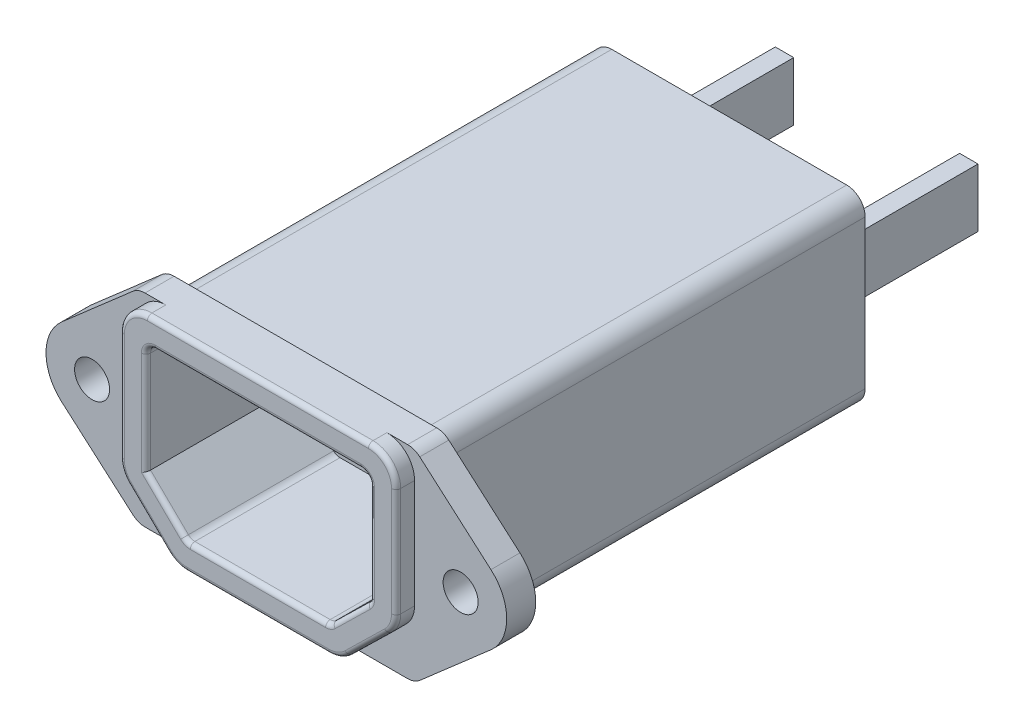
from build123d import *

# Parameters (mm, degrees)
SKETCH1_R           = 1.9
BOSS_EXTRUDE1_DEPTH = 3.15
BOSS_EXTRUDE2_DEPTH = 2
FILLET1_R           = 0.5
BOSS_EXTRUDE3_DEPTH = 46
SKETCH4_W           = 2
SKETCH4_H           = 6.35
BOSS_EXTRUDE4_DEPTH = 16
CUT_EXTRUDE1_START  = -11.1
CUT_EXTRUDE1_DEPTH  = 11.1


with BuildPart() as part:
    # Sketch1 → Boss-Extrude1 (new body)
    with BuildSketch(Plane.XY):
        with BuildLine():
            Line((-15.565068493, 10.506849315), (-23.287671233, 3.767123288))
            ThreePointArc((-23.287671233, 3.767123288), (-25, 0), (-23.287671233, -3.767123288))
            Line((-23.287671233, -3.767123288), (-15.565068493, -10.506849315))
            ThreePointArc((-15.565068493, -10.506849315), (-14.952246883, -10.872658355), (-14.25, -11))
            Line((-14.25, -11), (14.25, -11))
            ThreePointArc((14.25, -11), (14.952246883, -10.872658355), (15.565068493, -10.506849315))
            Line((15.565068493, -10.506849315), (23.287671233, -3.767123288))
            ThreePointArc((23.287671233, -3.767123288), (25, 0), (23.287671233, 3.767123288))
            Line((23.287671233, 3.767123288), (15.565068493, 10.506849315))
            ThreePointArc((15.565068493, 10.506849315), (14.952246883, 10.872658355), (14.25, 11))
            Line((14.25, 11), (-14.25, 11))
            ThreePointArc((-14.25, 11), (-14.952246883, 10.872658355), (-15.565068493, 10.506849315))
        make_face()
        with Locations((-20, 0)):
            Circle(SKETCH1_R, mode=Mode.SUBTRACT)
        with Locations((20, 0)):
            Circle(SKETCH1_R, mode=Mode.SUBTRACT)
        with BuildLine():
            Line((7.342503403, -8.15), (-7.342503403, -8.15))
            ThreePointArc((-7.342503403, -8.15), (-7.719871127, -8.076063497), (-8.041436351, -7.865187202))
            Line((-8.041436351, -7.865187202), (-12.15, -3.85))
            Line((-12.15, -3.85), (-12.15, 7.15))
            ThreePointArc((-12.15, 7.15), (-11.857106781, 7.857106781), (-11.15, 8.15))
            Line((-11.15, 8.15), (11.15, 8.15))
            ThreePointArc((11.15, 8.15), (11.857106781, 7.857106781), (12.15, 7.15))
            Line((12.15, 7.15), (12.15, -3.429037417))
            ThreePointArc((12.15, -3.429037417), (12.071665055, -3.817023919), (11.848932948, -4.144224619))
            Line((11.848932948, -4.144224619), (8.041436351, -7.865187202))
            ThreePointArc((8.041436351, -7.865187202), (7.719871127, -8.076063497), (7.342503403, -8.15))
        make_face(mode=Mode.SUBTRACT)
    extrude(amount=BOSS_EXTRUDE1_DEPTH)

    # Sketch2 → Boss-Extrude2 (add)
    with BuildSketch(Plane.XY.offset(3.15)):
        with BuildLine():
            Line((15, -3.786855613), (15, 8))
            ThreePointArc((15, 8), (14.121320344, 10.121320344), (12, 11))
            Line((12, 11), (-12, 11))
            ThreePointArc((-12, 11), (-14.121320344, 10.121320344), (-15, 8))
            Line((-15, 8), (-15, -3.786855613))
            ThreePointArc((-15, -3.786855613), (-14.764995165, -4.95081512), (-14.096798843, -5.93241722))
            Line((-14.096798843, -5.93241722), (-9.785674354, -10.145561607))
            ThreePointArc((-9.785674354, -10.145561607), (-8.820978681, -10.778190492), (-7.68887551, -11))
            Line((-7.68887551, -11), (7.68887551, -11))
            ThreePointArc((7.68887551, -11), (8.820978681, -10.778190492), (9.785674354, -10.145561607))
            Line((9.785674354, -10.145561607), (14.096798843, -5.93241722))
            ThreePointArc((14.096798843, -5.93241722), (14.764995165, -4.95081512), (15, -3.786855613))
        make_face()
        with BuildLine():
            Line((-8.041436351, -7.865187202), (-12.15, -3.85))
            Line((-12.15, -3.85), (-12.15, 7.15))
            ThreePointArc((-12.15, 7.15), (-11.857106781, 7.857106781), (-11.15, 8.15))
            Line((-11.15, 8.15), (11.15, 8.15))
            ThreePointArc((11.15, 8.15), (11.857106781, 7.857106781), (12.15, 7.15))
            Line((12.15, 7.15), (12.15, -3.429037417))
            ThreePointArc((12.15, -3.429037417), (12.071665055, -3.817023919), (11.848932948, -4.144224619))
            Line((11.848932948, -4.144224619), (8.041436351, -7.865187202))
            ThreePointArc((8.041436351, -7.865187202), (7.719871127, -8.076063497), (7.342503403, -8.15))
            Line((7.342503403, -8.15), (-7.342503403, -8.15))
            ThreePointArc((-7.342503403, -8.15), (-7.719871127, -8.076063497), (-8.041436351, -7.865187202))
        make_face(mode=Mode.SUBTRACT)
    extrude(amount=BOSS_EXTRUDE2_DEPTH)

    # Fillet1
    fillet1_edges = [part.edges().sort_by_distance(p)[0] for p in [
        (-12.15, 1.65, 5.15),
        (-10.095718176, -5.857593601, 5.15),
        (8.820978681, -10.778190492, 5.15),
        (11.941236599, -8.038989413, 5.15),
        (14.764995165, -4.95081512, 5.15),
        (15, 2.106572194, 5.15),
        (14.121320344, 10.121320344, 5.15),
        (0, 11, 5.15),
        (-14.121320344, 10.121320344, 5.15),
        (-15, 2.106572194, 5.15),
        (-14.764995165, -4.95081512, 5.15),
        (-11.941236599, -8.038989413, 5.15),
        (-8.820978681, -10.778190492, 5.15),
        (0, -11, 5.15),
        (-7.719871127, -8.076063497, 5.15),
        (0, -8.15, 5.15),
        (7.719871127, -8.076063497, 5.15),
        (9.945184649, -6.004705911, 5.15),
        (12.071665055, -3.817023919, 5.15),
        (12.15, 1.860481292, 5.15),
        (11.857106781, 7.857106781, 5.15),
        (0, 8.15, 5.15),
        (-11.857106781, 7.857106781, 5.15),
    ]]
    fillet(fillet1_edges, radius=FILLET1_R)

    # Sketch3 → Boss-Extrude3 (add)
    with BuildSketch(Plane(origin=(0, 0, 0), x_dir=(-1, 0, 0), z_dir=(0, 0, -1))):
        with BuildLine():
            Line((12.75, -10.075), (-12.75, -10.075))
            ThreePointArc((-12.75, -10.075), (-14.164213562, -9.489213562), (-14.75, -8.075))
            Line((-14.75, -8.075), (-14.75, 8.075))
            ThreePointArc((-14.75, 8.075), (-14.164213562, 9.489213562), (-12.75, 10.075))
            Line((-12.75, 10.075), (12.75, 10.075))
            ThreePointArc((12.75, 10.075), (14.164213562, 9.489213562), (14.75, 8.075))
            Line((14.75, 8.075), (14.75, -8.075))
            ThreePointArc((14.75, -8.075), (14.164213562, -9.489213562), (12.75, -10.075))
        make_face()
    extrude(amount=BOSS_EXTRUDE3_DEPTH)

    # Sketch4 → Boss-Extrude4 (add)
    with BuildSketch(Plane(origin=(0, 0, -46), x_dir=(-1, 0, 0), z_dir=(0, 0, -1))):
        with Locations((-10, 0)):
            Rectangle(SKETCH4_W, SKETCH4_H)
        with Locations((10, 0)):
            Rectangle(SKETCH4_W, SKETCH4_H)
    extrude(amount=BOSS_EXTRUDE4_DEPTH)

    # Sketch5 → Cut-Extrude1 (cut)
    with BuildSketch(Plane.XY.offset(CUT_EXTRUDE1_START)):
        with BuildLine():
            Line((-12.15, 7.15), (-12.15, -3.85))
            Line((-12.15, -3.85), (-8.041436351, -7.865187202))
            ThreePointArc((-8.041436351, -7.865187202), (-7.719871127, -8.076063497), (-7.342503403, -8.15))
            Line((-7.342503403, -8.15), (7.342503403, -8.15))
            ThreePointArc((7.342503403, -8.15), (7.719871127, -8.076063497), (8.041436351, -7.865187202))
            Line((8.041436351, -7.865187202), (11.848932948, -4.144224619))
            ThreePointArc((11.848932948, -4.144224619), (12.071665055, -3.817023919), (12.15, -3.429037417))
            Line((12.15, -3.429037417), (12.15, 7.15))
            ThreePointArc((12.15, 7.15), (11.857106781, 7.857106781), (11.15, 8.15))
            Line((11.15, 8.15), (-11.15, 8.15))
            ThreePointArc((-11.15, 8.15), (-11.857106781, 7.857106781), (-12.15, 7.15))
        make_face()
    extrude(amount=CUT_EXTRUDE1_DEPTH, mode=Mode.SUBTRACT)


solid = part.part
